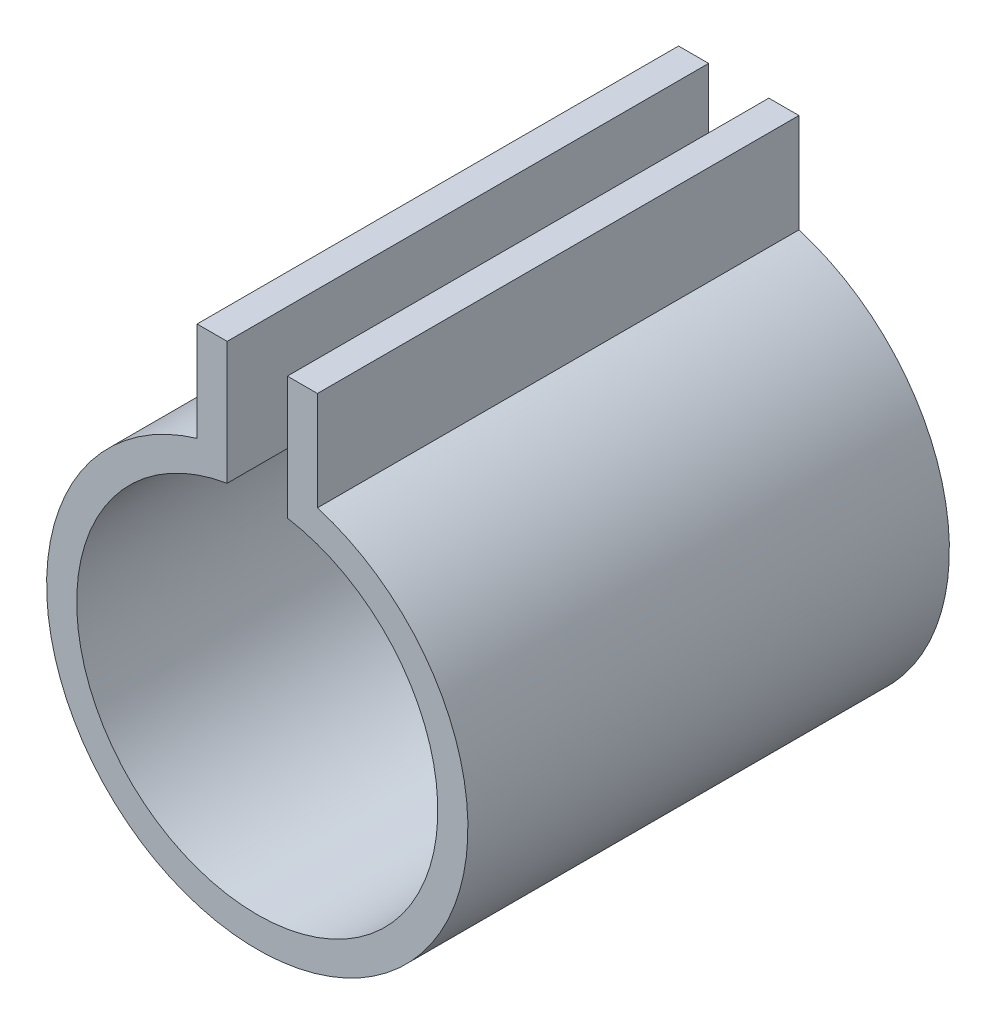
from build123d import *

# Parameters (mm, degrees)
BOSS_EXTRUDE1_DEPTH = 50.8


with BuildPart() as part:
    # Sketch2 → Boss-Extrude1 (new body)
    with BuildSketch(Plane.XY):
        with BuildLine():
            Line((3.175, 22.86), (3.175, 31.75))
            Line((3.175, 31.75), (6.35, 31.75))
            Line((6.35, 31.75), (6.35, 21.298547486))
            ThreePointArc((6.35, 21.298547486), (0, -22.225), (-6.35, 21.298547486))
            Line((-6.35, 21.298547486), (-6.35, 31.75))
            Line((-6.35, 31.75), (-3.175, 31.75))
            Line((-3.175, 31.75), (-3.175, 22.86))
            Line((-3.175, 22.86), (-3.175, 18.783553311))
            ThreePointArc((-3.175, 18.783553311), (0, -19.05), (3.175, 18.783553311))
            Line((3.175, 18.783553311), (3.175, 22.86))
        make_face()
    extrude(amount=BOSS_EXTRUDE1_DEPTH)


solid = part.part
